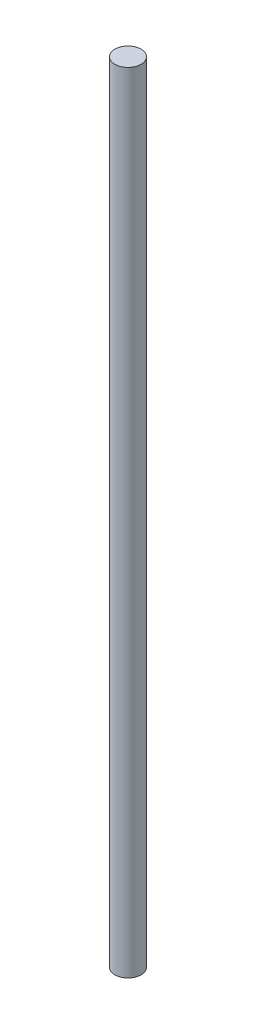
from build123d import *

# Parameters (mm, degrees)
SKETCH1_R           = 6
BOSS_EXTRUDE1_DEPTH = 361


with BuildPart() as part:
    # Sketch1 → Boss-Extrude1 (new body)
    with BuildSketch(Plane(origin=(0, 0, 0), x_dir=(1, 0, 0), z_dir=(0, 1, 0))):
        with Locations(Location((0, 0, 0), (0, 0, 270))):
            Circle(SKETCH1_R)
    extrude(amount=BOSS_EXTRUDE1_DEPTH)


solid = part.part
